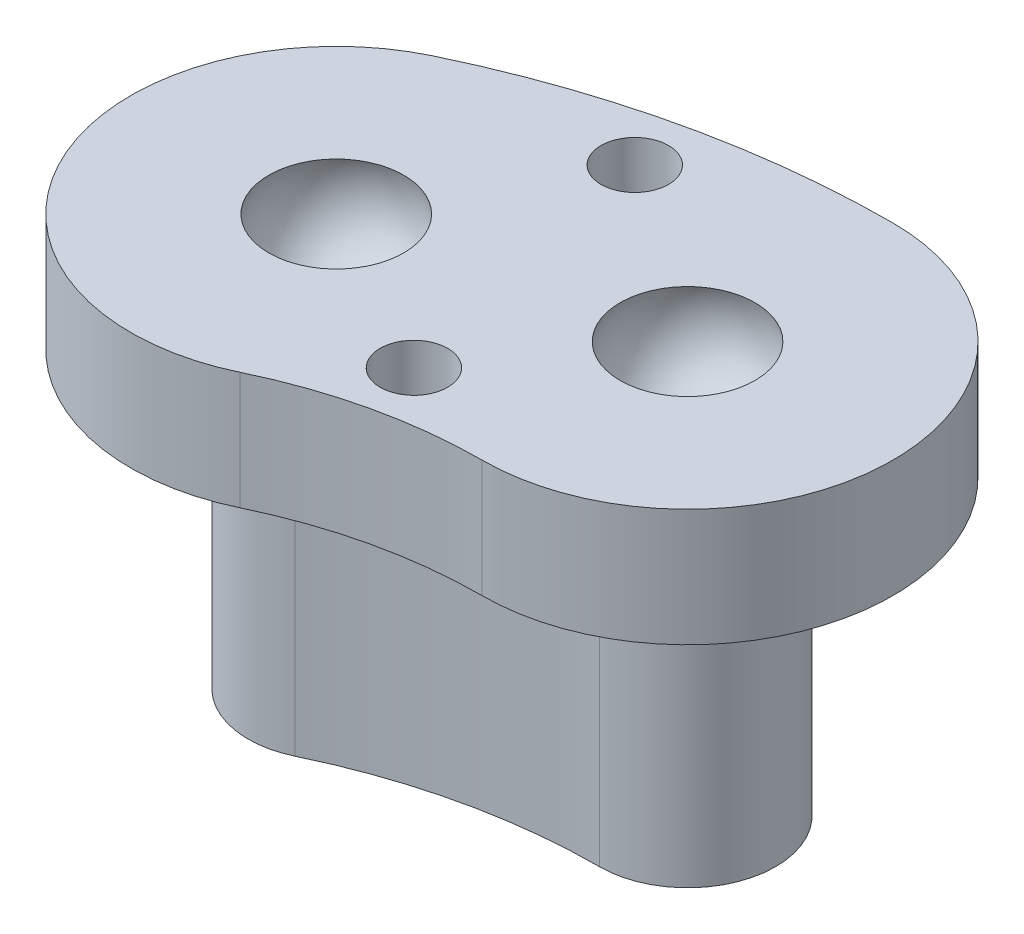
from build123d import *

# Parameters (mm, degrees)
EXTRUDE_1_DEPTH     = 10
EXTRUDE_2_DEPTH     = 4
SKETCH_6_R          = 1.15
CUT_EXTRUDE_2_DEPTH = 10


with BuildPart() as part:
    # 草图1 → 凸台-拉伸1 (new body)
    with BuildSketch(Plane(origin=(0, 0, 0), x_dir=(1, 0, 0), z_dir=(0, 1, 0))):
        with BuildLine():
            ThreePointArc((0, 25.5), (-5.666666667, 24.862399098), (-11.049955154, 22.981481481))
            ThreePointArc((-11.049955154, 22.981481481), (-12.453664134, 18.977783054), (-8.449965706, 17.574074074))
            ThreePointArc((-8.449965706, 17.574074074), (-4.333333333, 19.012422839), (0, 19.5))
            ThreePointArc((0, 19.5), (3, 22.5), (0, 25.5))
        make_face()
    extrude(amount=EXTRUDE_1_DEPTH)

    # 草图2 → 凸台-拉伸2 (add)
    with BuildSketch(Plane(origin=(0, 10, 0), x_dir=(1, 0, 0), z_dir=(0, 1, 0))):
        with BuildLine():
            ThreePointArc((0, 29.5), (-6.555555556, 28.76238327), (-12.783281453, 26.586419753))
            ThreePointArc((-12.783281453, 26.586419753), (-16.058602406, 17.244456755), (-6.716639408, 13.969135802))
            ThreePointArc((-6.716639408, 13.969135802), (-3.444444444, 15.112438667), (0, 15.5))
            ThreePointArc((0, 15.5), (7, 22.5), (0, 29.5))
        make_face()
    extrude(amount=EXTRUDE_2_DEPTH)

    # 草图3 → 切除-旋转1 (revolve, cut)
    with BuildSketch(Plane(origin=(0, 13.15, 0), x_dir=(1, 0, 0), z_dir=(0, 1, 0))):
        with BuildLine():
            Line((-9.74996043, 22.727777778), (-9.74996043, 17.827777778))
            ThreePointArc((-9.74996043, 17.827777778), (-12.19996043, 20.277777778), (-9.74996043, 22.727777778))
        make_face()
    revolve(axis=Axis((-9.74996043, 13.15, -22.727777778), (0, 0, 1)), mode=Mode.SUBTRACT)

    # 草图4 → 切除-旋转2 (revolve, cut)
    with BuildSketch(Plane(origin=(0, 13.15, 0), x_dir=(1, 0, 0), z_dir=(0, 1, 0))):
        with BuildLine():
            Line((0, 24.95), (0, 20.05))
            ThreePointArc((0, 20.05), (-2.45, 22.5), (0, 24.95))
        make_face()
    revolve(axis=Axis((0, 13.15, -24.95), (0, 0, 1)), mode=Mode.SUBTRACT)

    # 草图6 → 切除-拉伸2 (cut)
    with BuildSketch(Plane(origin=(0, 14, 0), x_dir=(1, 0, 0), z_dir=(0, 1, 0))):
        with Locations(Location((-6.111111111, 26.812391184, 0), (0, 0, 270))):
            Circle(SKETCH_6_R)
        with Locations(Location((-3.888888889, 17.062430753, 0), (0, 0, 270))):
            Circle(SKETCH_6_R)
    extrude(amount=-CUT_EXTRUDE_2_DEPTH, mode=Mode.SUBTRACT)


solid = part.part
